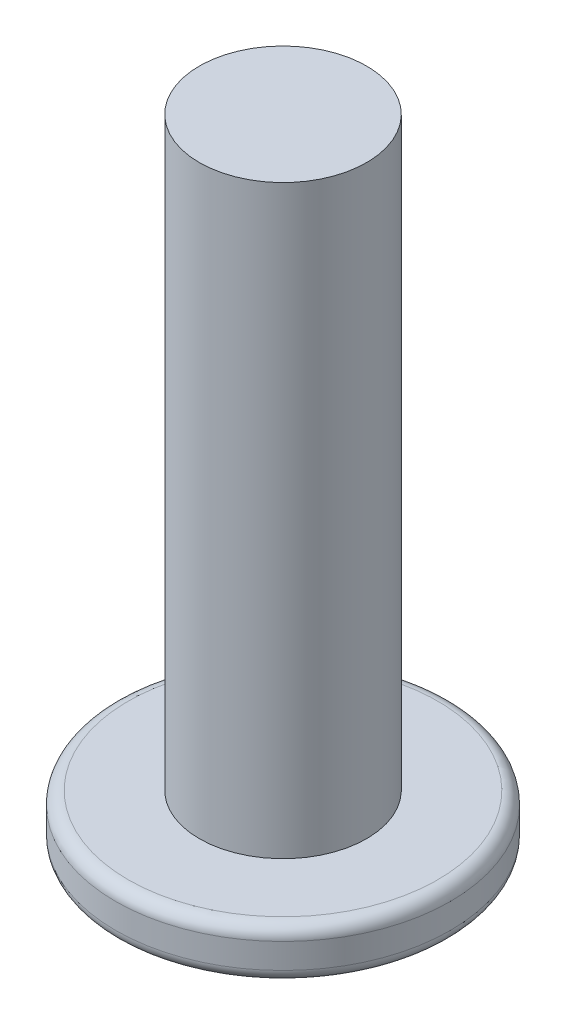
from build123d import *

# Parameters (mm, degrees)
SKETCH1_R           = 4
BOSS_EXTRUDE1_DEPTH = 1.2
SKETCH2_R           = 2
BOSS_EXTRUDE2_DEPTH = 14
FILLET2_R           = 0.3
CUT_EXTRUDE1_DEPTH  = 0.6


with BuildPart() as part:
    # Sketch1 → Boss-Extrude1 (new body)
    with BuildSketch(Plane(origin=(0, 0, 0), x_dir=(1, 0, 0), z_dir=(0, 1, 0))):
        with Locations(Location((0, 0, 0), (0, 0, 270))):
            Circle(SKETCH1_R)
    extrude(amount=BOSS_EXTRUDE1_DEPTH)

    # Sketch2 → Boss-Extrude2 (add)
    with BuildSketch(Plane(origin=(0, 1.2, 0), x_dir=(1, 0, 0), z_dir=(0, 1, 0))):
        with Locations(Location((0, 0, 0), (0, 0, 270))):
            Circle(SKETCH2_R)
    extrude(amount=BOSS_EXTRUDE2_DEPTH)

    # Fillet2
    fillet2_edges = [part.edges().sort_by_distance(p)[0] for p in [
        (0, 0, -4),
        (0, 1.2, -4),
    ]]
    fillet(fillet2_edges, radius=FILLET2_R)

    # Sketch3 → Cut-Extrude1 (cut)
    with BuildSketch(Plane.XZ):
        Polygon((1.732050808, 0), (0.866025404, 1.5), (-0.866025404, 1.5), (-1.732050808, 0), (-0.866025404, -1.5), (0.866025404, -1.5), align=None)
    extrude(amount=-CUT_EXTRUDE1_DEPTH, mode=Mode.SUBTRACT)


solid = part.part
